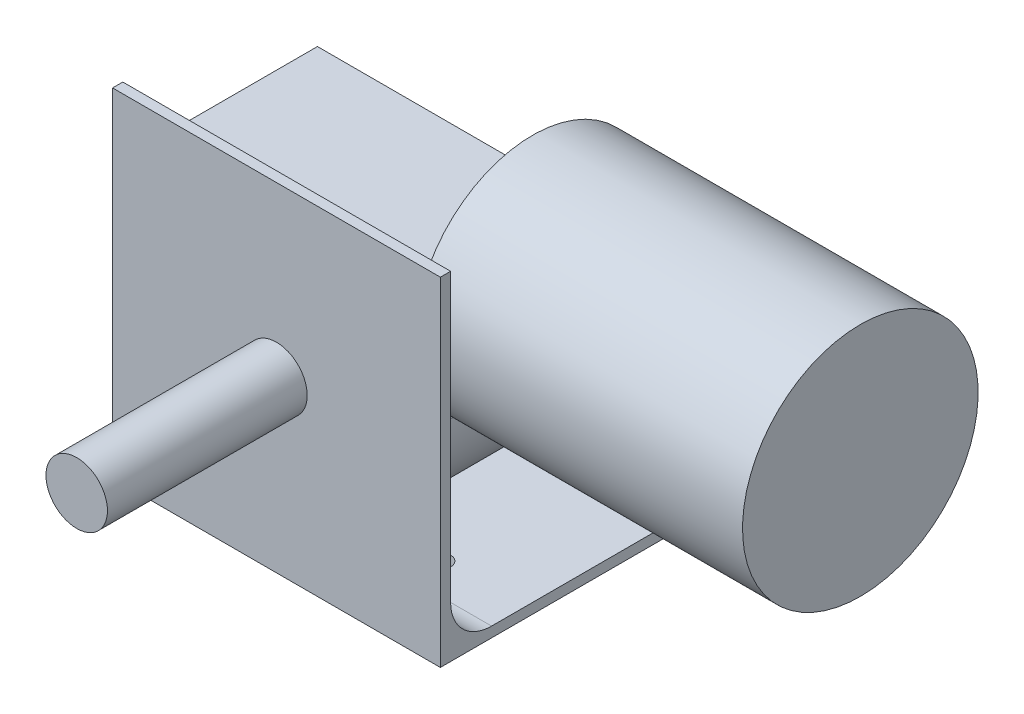
from build123d import *

# Parameters (mm, degrees)
SKETCH1_W                    = 101.6
SKETCH1_H                    = 101.6
EXTRUDE1_DEPTH               = 3.175
SKETCH2_W                    = 101.6
SKETCH2_H                    = 3.175
EXTRUDE2_DEPTH               = 101.6
FILLET1_R                    = 12.7
SKETCH3_R                    = 9.525
EXTRUDE3_DEPTH               = 61.9125
F_97_0_0059_DIAMETER_HOLE1_D = 6.35
SKETCH7_R                    = 38.1
SKETCH7_W                    = 76.2
SKETCH7_H                    = 44.45
EXTRUDE4_DEPTH               = 47.625
SKETCH10_R                   = 36.5125
EXTRUDE12_DEPTH              = 101.6


with BuildPart() as part:
    # Sketch1 → Extrude1 (new body)
    with BuildSketch(Plane(origin=(0, 0, 0), x_dir=(1, 0, 0), z_dir=(0, 1, 0))):
        Rectangle(SKETCH1_W, SKETCH1_H)
    extrude(amount=EXTRUDE1_DEPTH)

    # Sketch2 → Extrude2 (add)
    with BuildSketch(Plane(origin=(0, 3.175, 0), x_dir=(1, 0, 0), z_dir=(0, 1, 0))):
        with Locations((0, -49.2125)):
            Rectangle(SKETCH2_W, SKETCH2_H)
    extrude(amount=EXTRUDE2_DEPTH)

    # Fillet1
    fillet1_edges = [part.edges().sort_by_distance(p)[0] for p in [
        (0, 3.175, 47.625),
    ]]
    fillet(fillet1_edges, radius=FILLET1_R)

    # Sketch3 → Extrude3 (add)
    with BuildSketch(Plane.XY.offset(50.8)):
        with Locations(Location((0, 52.3875, 0), (0, 0, 180))):
            Circle(SKETCH3_R)
    extrude(amount=EXTRUDE3_DEPTH)

    # #97 (0.0059) Diameter Hole1 (through all)
    with Locations(Plane(origin=(0, 3.175, 0), x_dir=(-1, 0, 0), z_dir=(0, 1, 0))):
        with Locations((-25.4, 25.4), (25.4, 25.4), (25.4, -25.4), (-25.4, -25.4)):
            Hole(F_97_0_0059_DIAMETER_HOLE1_D / 2)

    # Sketch7 → Extrude4 (add)
    with BuildSketch(Plane(origin=(0, 0, 47.625), x_dir=(-1, 0, 0), z_dir=(0, 0, -1))):
        with Locations((0, 52.3875)):
            Circle(SKETCH7_R)
        with Locations((0, 74.6125)):
            Rectangle(SKETCH7_W, SKETCH7_H)
    extrude(amount=EXTRUDE4_DEPTH)

    # Sketch10 → Extrude12 (add)
    with BuildSketch(Plane(origin=(38.1, 0, 0), x_dir=(0, 0, -1), z_dir=(1, 0, 0))):
        with Locations(Location((-9.525, 79.375, 0), (0, 0, 227.657394548))):
            Circle(SKETCH10_R)
    extrude(amount=EXTRUDE12_DEPTH)


solid = part.part
